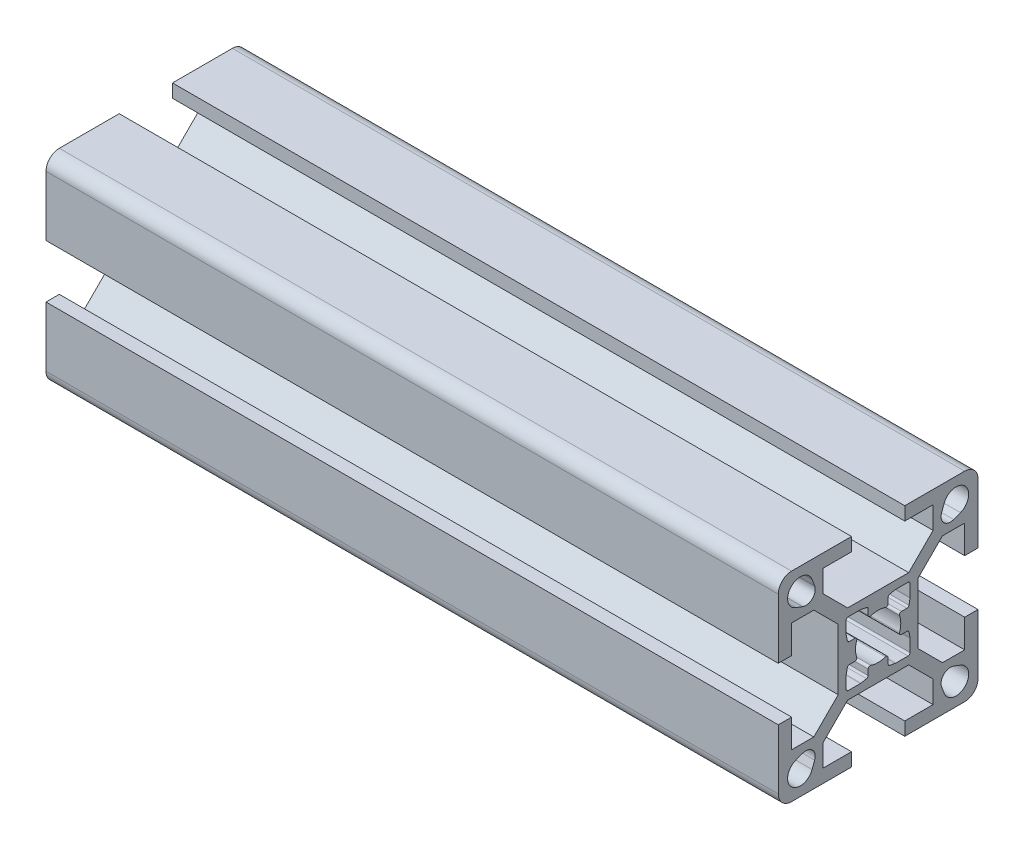
from build123d import *

# Parameters (mm, degrees)
BOSS_EXTRUDE1_DEPTH = 110


with BuildPart() as part:
    # Sketch1 → Boss-Extrude1 (new body)
    with BuildSketch(Plane(origin=(0, 0, 0), x_dir=(0, 0, -1), z_dir=(1, 0, 0))):
        with BuildLine():
            Line((-15, 13), (-15, 4))
            Line((-15, 4), (-13, 4))
            Line((-13, 4), (-13, 8.25))
            Line((-13, 8.25), (-9.664213562, 8.25))
            Line((-9.664213562, 8.25), (-6, 4.585786438))
            Line((-6, 4.585786438), (-6, -4.585786438))
            Line((-6, -4.585786438), (-9.664213562, -8.25))
            Line((-9.664213562, -8.25), (-13, -8.25))
            Line((-13, -8.25), (-13, -4))
            Line((-13, -4), (-15, -4))
            Line((-15, -4), (-15, -13))
            ThreePointArc((-15, -13), (-14.414213562, -14.414213562), (-13, -15))
            Line((-13, -15), (-4, -15))
            Line((-4, -15), (-4, -13))
            Line((-4, -13), (-8.25, -13))
            Line((-8.25, -13), (-8.25, -9.664213562))
            Line((-8.25, -9.664213562), (-4.585786438, -6))
            Line((-4.585786438, -6), (4.585786438, -6))
            Line((4.585786438, -6), (8.25, -9.664213562))
            Line((8.25, -9.664213562), (8.25, -13))
            Line((8.25, -13), (4, -13))
            Line((4, -13), (4, -15))
            Line((4, -15), (13, -15))
            ThreePointArc((13, -15), (14.414213562, -14.414213562), (15, -13))
            Line((15, -13), (15, -4))
            Line((15, -4), (13, -4))
            Line((13, -4), (13, -8.25))
            Line((13, -8.25), (9.664213562, -8.25))
            Line((9.664213562, -8.25), (6, -4.585786438))
            Line((6, -4.585786438), (6, 4.585786438))
            Line((6, 4.585786438), (9.664213562, 8.25))
            Line((9.664213562, 8.25), (13, 8.25))
            Line((13, 8.25), (13, 4))
            Line((13, 4), (15, 4))
            Line((15, 4), (15, 13))
            ThreePointArc((15, 13), (14.414213562, 14.414213562), (13, 15))
            Line((13, 15), (4, 15))
            Line((4, 15), (4, 13))
            Line((4, 13), (8.25, 13))
            Line((8.25, 13), (8.25, 9.664213562))
            Line((8.25, 9.664213562), (4.585786438, 6))
            Line((4.585786438, 6), (-4.585786438, 6))
            Line((-4.585786438, 6), (-8.25, 9.664213562))
            Line((-8.25, 9.664213562), (-8.25, 13))
            Line((-8.25, 13), (-4, 13))
            Line((-4, 13), (-4, 15))
            Line((-4, 15), (-13, 15))
            ThreePointArc((-13, 15), (-14.414213562, 14.414213562), (-15, 13))
        make_face()
        with BuildLine():
            Line((-9.539070071, 11.338915743), (-9.918883282, 12.361530981))
            ThreePointArc((-9.918883282, 12.361530981), (-13.043502884, 13.043502884), (-12.361530981, 9.918883282))
            Line((-12.361530981, 9.918883282), (-11.338915743, 9.539070071))
            ThreePointArc((-11.338915743, 9.539070071), (-9.861522369, 9.861522369), (-9.539070071, 11.338915743))
        make_face(mode=Mode.SUBTRACT)
        with BuildLine():
            Line((9.918883282, 12.361530981), (9.539070071, 11.338915743))
            ThreePointArc((9.539070071, 11.338915743), (9.861522369, 9.861522369), (11.338915743, 9.539070071))
            Line((11.338915743, 9.539070071), (12.361530981, 9.918883282))
            ThreePointArc((12.361530981, 9.918883282), (13.043502884, 13.043502884), (9.918883282, 12.361530981))
        make_face(mode=Mode.SUBTRACT)
        with BuildLine():
            Line((12.361530981, -9.918883282), (11.338915743, -9.539070071))
            ThreePointArc((11.338915743, -9.539070071), (9.861522369, -9.861522369), (9.539070071, -11.338915743))
            Line((9.539070071, -11.338915743), (9.918883282, -12.361530981))
            ThreePointArc((9.918883282, -12.361530981), (13.043502884, -13.043502884), (12.361530981, -9.918883282))
        make_face(mode=Mode.SUBTRACT)
        with BuildLine():
            Line((-11.338915743, -9.539070071), (-12.361530981, -9.918883282))
            ThreePointArc((-12.361530981, -9.918883282), (-13.043502884, -13.043502884), (-9.918883282, -12.361530981))
            Line((-9.918883282, -12.361530981), (-9.539070071, -11.338915743))
            ThreePointArc((-9.539070071, -11.338915743), (-9.861522369, -9.861522369), (-11.338915743, -9.539070071))
        make_face(mode=Mode.SUBTRACT)
        with BuildLine():
            Line((-4.8, -2.644433572), (-4.8, -4.5))
            ThreePointArc((-4.8, -4.5), (-4.712132034, -4.712132034), (-4.5, -4.8))
            Line((-4.5, -4.8), (-2.644433572, -4.8))
            ThreePointArc((-2.644433572, -4.8), (-2.615679847, -4.79861886), (-2.587190874, -4.794488155))
            Line((-2.587190874, -4.794488155), (-1.742757301, -4.630346896))
            ThreePointArc((-1.742757301, -4.630346896), (-1.568512625, -4.526682207), (-1.5, -4.335858741))
            Line((-1.5, -4.335858741), (-1.5, -3.5))
            ThreePointArc((-1.5, -3.5), (-1.374371458, -3.255879959), (-1.102702703, -3.216216216))
            ThreePointArc((-1.102702703, -3.216216216), (0, -3.4), (1.102702703, -3.216216216))
            ThreePointArc((1.102702703, -3.216216216), (1.374371458, -3.255879959), (1.5, -3.5))
            Line((1.5, -3.5), (1.5, -4.335858741))
            ThreePointArc((1.5, -4.335858741), (1.568512625, -4.526682207), (1.742757301, -4.630346896))
            Line((1.742757301, -4.630346896), (2.587190874, -4.794488155))
            ThreePointArc((2.587190874, -4.794488155), (2.615679847, -4.79861886), (2.644433572, -4.8))
            Line((2.644433572, -4.8), (4.5, -4.8))
            ThreePointArc((4.5, -4.8), (4.712132034, -4.712132034), (4.8, -4.5))
            Line((4.8, -4.5), (4.8, -2.644433572))
            ThreePointArc((4.8, -2.644433572), (4.79861886, -2.615679847), (4.794488155, -2.587190874))
            Line((4.794488155, -2.587190874), (4.630346896, -1.742757301))
            ThreePointArc((4.630346896, -1.742757301), (4.526682207, -1.568512625), (4.335858741, -1.5))
            Line((4.335858741, -1.5), (3.5, -1.5))
            ThreePointArc((3.5, -1.5), (3.255879959, -1.374371458), (3.216216216, -1.102702703))
            ThreePointArc((3.216216216, -1.102702703), (3.4, 0), (3.216216216, 1.102702703))
            ThreePointArc((3.216216216, 1.102702703), (3.255879959, 1.374371458), (3.5, 1.5))
            Line((3.5, 1.5), (4.335858741, 1.5))
            ThreePointArc((4.335858741, 1.5), (4.526682207, 1.568512625), (4.630346896, 1.742757301))
            Line((4.630346896, 1.742757301), (4.794488155, 2.587190874))
            ThreePointArc((4.794488155, 2.587190874), (4.79861886, 2.615679847), (4.8, 2.644433572))
            Line((4.8, 2.644433572), (4.8, 4.5))
            ThreePointArc((4.8, 4.5), (4.712132034, 4.712132034), (4.5, 4.8))
            Line((4.5, 4.8), (2.644433572, 4.8))
            ThreePointArc((2.644433572, 4.8), (2.615679847, 4.79861886), (2.587190874, 4.794488155))
            Line((2.587190874, 4.794488155), (1.742757301, 4.630346896))
            ThreePointArc((1.742757301, 4.630346896), (1.568512625, 4.526682207), (1.5, 4.335858741))
            Line((1.5, 4.335858741), (1.5, 3.5))
            ThreePointArc((1.5, 3.5), (1.374371458, 3.255879959), (1.102702703, 3.216216216))
            ThreePointArc((1.102702703, 3.216216216), (0, 3.4), (-1.102702703, 3.216216216))
            ThreePointArc((-1.102702703, 3.216216216), (-1.374371458, 3.255879959), (-1.5, 3.5))
            Line((-1.5, 3.5), (-1.5, 4.335858741))
            ThreePointArc((-1.5, 4.335858741), (-1.568512625, 4.526682207), (-1.742757301, 4.630346896))
            Line((-1.742757301, 4.630346896), (-2.587190874, 4.794488155))
            ThreePointArc((-2.587190874, 4.794488155), (-2.615679847, 4.79861886), (-2.644433572, 4.8))
            Line((-2.644433572, 4.8), (-4.5, 4.8))
            ThreePointArc((-4.5, 4.8), (-4.712132034, 4.712132034), (-4.8, 4.5))
            Line((-4.8, 4.5), (-4.8, 2.644433572))
            ThreePointArc((-4.8, 2.644433572), (-4.79861886, 2.615679847), (-4.794488155, 2.587190874))
            Line((-4.794488155, 2.587190874), (-4.630346896, 1.742757301))
            ThreePointArc((-4.630346896, 1.742757301), (-4.526682207, 1.568512625), (-4.335858741, 1.5))
            Line((-4.335858741, 1.5), (-3.5, 1.5))
            ThreePointArc((-3.5, 1.5), (-3.255879959, 1.374371458), (-3.216216216, 1.102702703))
            ThreePointArc((-3.216216216, 1.102702703), (-3.4, 0), (-3.216216216, -1.102702703))
            ThreePointArc((-3.216216216, -1.102702703), (-3.255879959, -1.374371458), (-3.5, -1.5))
            Line((-3.5, -1.5), (-4.335858741, -1.5))
            ThreePointArc((-4.335858741, -1.5), (-4.526682207, -1.568512625), (-4.630346896, -1.742757301))
            Line((-4.630346896, -1.742757301), (-4.794488155, -2.587190874))
            ThreePointArc((-4.794488155, -2.587190874), (-4.79861886, -2.615679847), (-4.8, -2.644433572))
        make_face(mode=Mode.SUBTRACT)
    extrude(amount=BOSS_EXTRUDE1_DEPTH)


solid = part.part
